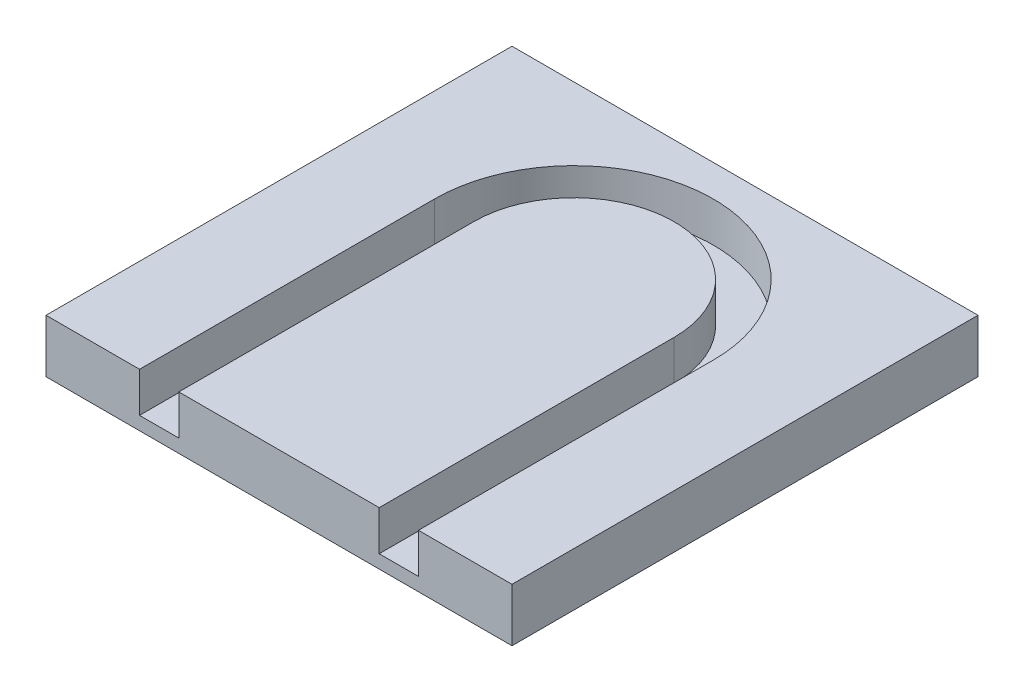
from build123d import *

# Parameters (mm, degrees)
SKETCH1_W           = 35
SKETCH1_H           = 35
BOSS_EXTRUDE1_DEPTH = 1
BOSS_EXTRUDE2_DEPTH = 3


with BuildPart() as part:
    # Sketch1 → Boss-Extrude1 (new body)
    with BuildSketch(Plane(origin=(0, 0, 0), x_dir=(1, 0, 0), z_dir=(0, 1, 0))):
        Rectangle(SKETCH1_W, SKETCH1_H)
    extrude(amount=BOSS_EXTRUDE1_DEPTH)

    # Sketch2 → Boss-Extrude2 (add)
    with BuildSketch(Plane(origin=(0, 1, 0), x_dir=(1, 0, 0), z_dir=(0, 1, 0))):
        with BuildLine():
            Line((-17.5, -17.5), (-10.475, -17.5))
            Line((-10.475, -17.5), (-10.475, 4.65042043))
            ThreePointArc((-10.475, 4.65042043), (0, 15.12542043), (10.475, 4.65042043))
            Line((10.475, 4.65042043), (10.475, -17.5))
            Line((10.475, -17.5), (17.5, -17.5))
            Line((17.5, -17.5), (17.5, 17.5))
            Line((17.5, 17.5), (-17.5, 17.5))
            Line((-17.5, 17.5), (-17.5, -17.5))
        make_face()
        with BuildLine():
            Line((-7.525, 4.65042043), (-7.525, -17.5))
            Line((-7.525, -17.5), (7.525, -17.5))
            Line((7.525, -17.5), (7.525, 4.65042043))
            ThreePointArc((7.525, 4.65042043), (0, 12.17542043), (-7.525, 4.65042043))
        make_face()
    extrude(amount=BOSS_EXTRUDE2_DEPTH)


solid = part.part
